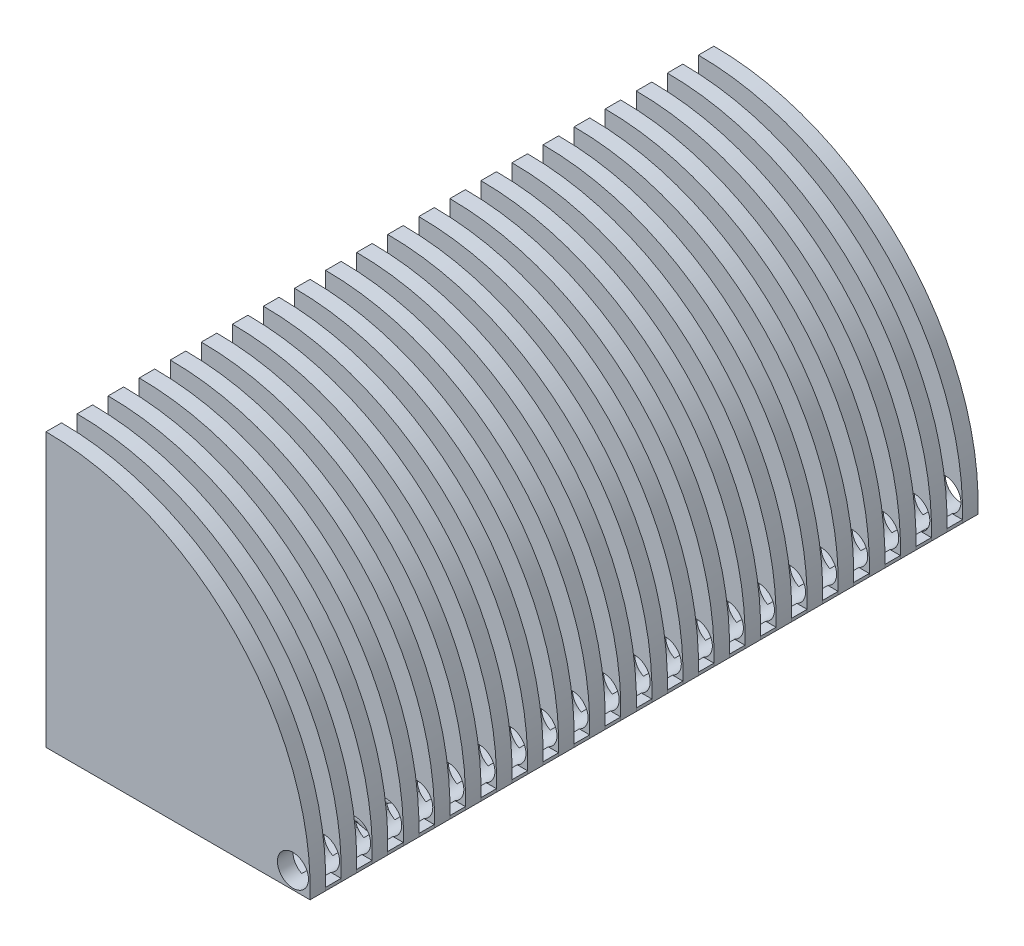
from build123d import *

# Parameters (mm, degrees)
BOSS_EXTRUDE1_DEPTH = 5
LPATTERN1_COUNT     = 22
LPATTERN1_PITCH     = 10
SKETCH3_W           = 85
SKETCH3_H           = 215
BOSS_EXTRUDE2_DEPTH = 1
SKETCH2_R           = 5
CUT_EXTRUDE3_DEPTH  = 248.391786033


with BuildPart() as part:
    # Sketch1 → Boss-Extrude1 (new body)
    with BuildSketch(Plane.XY):
        with BuildLine():
            Line((85, 0), (0, 0))
            Line((0, 0), (0, 88))
            ThreePointArc((0, 88), (61.173932357, 62.037321026), (85, 0))
        make_face()
    extrude(amount=BOSS_EXTRUDE1_DEPTH)


with BuildPart() as lpattern1_1:
    # LPattern1: pattern copy
    add(part.part.moved(Location(Vector(0, 0, -1) * (1 * LPATTERN1_PITCH))))


with BuildPart() as lpattern1_2:
    # LPattern1: pattern copy
    add(part.part.moved(Location(Vector(0, 0, -1) * (2 * LPATTERN1_PITCH))))


with BuildPart() as lpattern1_3:
    # LPattern1: pattern copy
    add(part.part.moved(Location(Vector(0, 0, -1) * (3 * LPATTERN1_PITCH))))


with BuildPart() as lpattern1_4:
    # LPattern1: pattern copy
    add(part.part.moved(Location(Vector(0, 0, -1) * (4 * LPATTERN1_PITCH))))


with BuildPart() as lpattern1_5:
    # LPattern1: pattern copy
    add(part.part.moved(Location(Vector(0, 0, -1) * (5 * LPATTERN1_PITCH))))


with BuildPart() as lpattern1_6:
    # LPattern1: pattern copy
    add(part.part.moved(Location(Vector(0, 0, -1) * (6 * LPATTERN1_PITCH))))


with BuildPart() as lpattern1_7:
    # LPattern1: pattern copy
    add(part.part.moved(Location(Vector(0, 0, -1) * (7 * LPATTERN1_PITCH))))


with BuildPart() as lpattern1_8:
    # LPattern1: pattern copy
    add(part.part.moved(Location(Vector(0, 0, -1) * (8 * LPATTERN1_PITCH))))


with BuildPart() as lpattern1_9:
    # LPattern1: pattern copy
    add(part.part.moved(Location(Vector(0, 0, -1) * (9 * LPATTERN1_PITCH))))


with BuildPart() as lpattern1_10:
    # LPattern1: pattern copy
    add(part.part.moved(Location(Vector(0, 0, -1) * (10 * LPATTERN1_PITCH))))


with BuildPart() as lpattern1_11:
    # LPattern1: pattern copy
    add(part.part.moved(Location(Vector(0, 0, -1) * (11 * LPATTERN1_PITCH))))


with BuildPart() as lpattern1_12:
    # LPattern1: pattern copy
    add(part.part.moved(Location(Vector(0, 0, -1) * (12 * LPATTERN1_PITCH))))


with BuildPart() as lpattern1_13:
    # LPattern1: pattern copy
    add(part.part.moved(Location(Vector(0, 0, -1) * (13 * LPATTERN1_PITCH))))


with BuildPart() as lpattern1_14:
    # LPattern1: pattern copy
    add(part.part.moved(Location(Vector(0, 0, -1) * (14 * LPATTERN1_PITCH))))


with BuildPart() as lpattern1_15:
    # LPattern1: pattern copy
    add(part.part.moved(Location(Vector(0, 0, -1) * (15 * LPATTERN1_PITCH))))


with BuildPart() as lpattern1_16:
    # LPattern1: pattern copy
    add(part.part.moved(Location(Vector(0, 0, -1) * (16 * LPATTERN1_PITCH))))


with BuildPart() as lpattern1_17:
    # LPattern1: pattern copy
    add(part.part.moved(Location(Vector(0, 0, -1) * (17 * LPATTERN1_PITCH))))


with BuildPart() as lpattern1_18:
    # LPattern1: pattern copy
    add(part.part.moved(Location(Vector(0, 0, -1) * (18 * LPATTERN1_PITCH))))


with BuildPart() as lpattern1_19:
    # LPattern1: pattern copy
    add(part.part.moved(Location(Vector(0, 0, -1) * (19 * LPATTERN1_PITCH))))


with BuildPart() as lpattern1_20:
    # LPattern1: pattern copy
    add(part.part.moved(Location(Vector(0, 0, -1) * (20 * LPATTERN1_PITCH))))


with BuildPart() as lpattern1_21:
    # LPattern1: pattern copy
    add(part.part.moved(Location(Vector(0, 0, -1) * (21 * LPATTERN1_PITCH))))


with BuildPart() as part_1:
    add(part.part)

    add(lpattern1_1.part)  # Boss-Extrude2 merges LPattern1_1

    add(lpattern1_2.part)  # Boss-Extrude2 merges LPattern1_2

    add(lpattern1_3.part)  # Boss-Extrude2 merges LPattern1_3

    add(lpattern1_4.part)  # Boss-Extrude2 merges LPattern1_4

    add(lpattern1_5.part)  # Boss-Extrude2 merges LPattern1_5

    add(lpattern1_6.part)  # Boss-Extrude2 merges LPattern1_6

    add(lpattern1_7.part)  # Boss-Extrude2 merges LPattern1_7

    add(lpattern1_8.part)  # Boss-Extrude2 merges LPattern1_8

    add(lpattern1_9.part)  # Boss-Extrude2 merges LPattern1_9

    add(lpattern1_10.part)  # Boss-Extrude2 merges LPattern1_10

    add(lpattern1_11.part)  # Boss-Extrude2 merges LPattern1_11

    add(lpattern1_12.part)  # Boss-Extrude2 merges LPattern1_12

    add(lpattern1_13.part)  # Boss-Extrude2 merges LPattern1_13

    add(lpattern1_14.part)  # Boss-Extrude2 merges LPattern1_14

    add(lpattern1_15.part)  # Boss-Extrude2 merges LPattern1_15

    add(lpattern1_16.part)  # Boss-Extrude2 merges LPattern1_16

    add(lpattern1_17.part)  # Boss-Extrude2 merges LPattern1_17

    add(lpattern1_18.part)  # Boss-Extrude2 merges LPattern1_18

    add(lpattern1_19.part)  # Boss-Extrude2 merges LPattern1_19

    add(lpattern1_20.part)  # Boss-Extrude2 merges LPattern1_20

    add(lpattern1_21.part)  # Boss-Extrude2 merges LPattern1_21
    # Sketch3 → Boss-Extrude2 (add)
    with BuildSketch(Plane(origin=(0, 0, 0), x_dir=(1, 0, 0), z_dir=(0, 1, 0))):
        with Locations((42.5, 102.5)):
            Rectangle(SKETCH3_W, SKETCH3_H)
    extrude(amount=BOSS_EXTRUDE2_DEPTH)

    # Sketch2 → Cut-Extrude3 (cut, through all)
    with BuildSketch(Plane.XY.offset(5)):
        with Locations((79.5, 5.5)):
            Circle(SKETCH2_R)
    extrude(amount=-CUT_EXTRUDE3_DEPTH, mode=Mode.SUBTRACT)


solid = part_1.part
